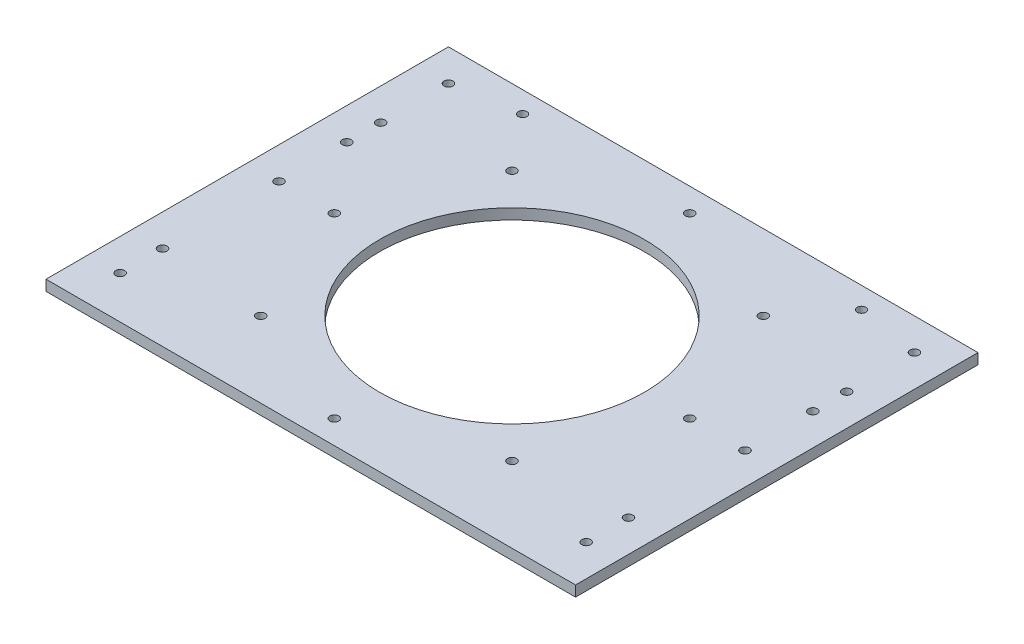
from build123d import *

# Parameters (mm, degrees)
SKETCH_1_W           = 250
SKETCH_1_H           = 190
EXTRUDE_1_DEPTH      = 5
SKETCH_2_R           = 2.1
CUT_EXTRUDE_1_DEPTH  = 10
SKETCH_3_R           = 62.5
CUT_EXTRUDE_2_DEPTH  = 10
CUT_EXTRUDE_3_REACH  = 159.083
SKETCH_4_R           = 2.1
SKETCH_5_OUTSIDE_W   = 314.81
SKETCH_5_OUTSIDE_H   = 254.81
SKETCH_5_OUTSIDE_W_2 = 250
SKETCH_5_OUTSIDE_H_2 = 190
SKETCH_5_OUTSIDE_R   = 2.05
CUT_EXTRUDE_4_DEPTH  = 10


with BuildPart() as part:
    # 草图1 → 凸台-拉伸1 (new body)
    with BuildSketch(Plane(origin=(0, 0, 0), x_dir=(1, 0, 0), z_dir=(0, 1, 0))):
        Rectangle(SKETCH_1_W, SKETCH_1_H)
    extrude(amount=EXTRUDE_1_DEPTH)

    # 草图2 → 切除-拉伸1 (cut)
    with BuildSketch(Plane(origin=(0, 5, 0), x_dir=(1, 0, 0), z_dir=(0, 1, 0))):
        with Locations(Location((-83.9, 0, 0), (0, 0, 270))):
            Circle(SKETCH_2_R)
        with Locations(Location((-59.326258942, 59.326258942, 0), (0, 0, 270))):
            Circle(SKETCH_2_R)
        with Locations(Location((0, 83.9, 0), (0, 0, 270))):
            Circle(SKETCH_2_R)
        with Locations(Location((59.326258942, 59.326258942, 0), (0, 0, 270))):
            Circle(SKETCH_2_R)
        with Locations(Location((83.9, 0, 0), (0, 0, 270))):
            Circle(SKETCH_2_R)
        with Locations(Location((59.326258942, -59.326258942, 0), (0, 0, 270))):
            Circle(SKETCH_2_R)
        with Locations(Location((0, -83.9, 0), (0, 0, 270))):
            Circle(SKETCH_2_R)
        with Locations(Location((-59.326258942, -59.326258942, 0), (0, 0, 270))):
            Circle(SKETCH_2_R)
    extrude(amount=-CUT_EXTRUDE_1_DEPTH, mode=Mode.SUBTRACT)

    # 草图3 → 切除-拉伸2 (cut)
    with BuildSketch(Plane(origin=(0, 5, 0), x_dir=(1, 0, 0), z_dir=(0, 1, 0))):
        with Locations(Location((0, 0, 0), (0, 0, 270))):
            Circle(SKETCH_3_R)
    extrude(amount=-CUT_EXTRUDE_2_DEPTH, mode=Mode.SUBTRACT)

    # 草图4 → 切除-拉伸3 (cut, up to next)
    with BuildSketch(Plane(origin=(0, 5, 0), x_dir=(1, 0, 0), z_dir=(0, 1, 0)), mode=Mode.PRIVATE) as cut_extrude_3_sk1:
        with Locations(Location((-110, 80, 0), (0, 0, 270))):
            Circle(SKETCH_4_R)
    cut_extrude_3_tool1 = extrude(cut_extrude_3_sk1.sketch, amount=-CUT_EXTRUDE_3_REACH, mode=Mode.PRIVATE) & part.part
    # 草图4 → 切除-拉伸3 (cut, up to next)
    with BuildSketch(Plane(origin=(0, 5, 0), x_dir=(1, 0, 0), z_dir=(0, 1, 0)), mode=Mode.PRIVATE) as cut_extrude_3_sk2:
        with Locations(Location((-110, 48, 0), (0, 0, 270))):
            Circle(SKETCH_4_R)
    cut_extrude_3_tool2 = extrude(cut_extrude_3_sk2.sketch, amount=-CUT_EXTRUDE_3_REACH, mode=Mode.PRIVATE) & part.part
    # 草图4 → 切除-拉伸3 (cut, up to next)
    with BuildSketch(Plane(origin=(0, 5, 0), x_dir=(1, 0, 0), z_dir=(0, 1, 0)), mode=Mode.PRIVATE) as cut_extrude_3_sk3:
        with Locations(Location((110, 48, 0), (0, 0, 270))):
            Circle(SKETCH_4_R)
    cut_extrude_3_tool3 = extrude(cut_extrude_3_sk3.sketch, amount=-CUT_EXTRUDE_3_REACH, mode=Mode.PRIVATE) & part.part
    # 草图4 → 切除-拉伸3 (cut, up to next)
    with BuildSketch(Plane(origin=(0, 5, 0), x_dir=(1, 0, 0), z_dir=(0, 1, 0)), mode=Mode.PRIVATE) as cut_extrude_3_sk4:
        with Locations(Location((110, 80, 0), (0, 0, 270))):
            Circle(SKETCH_4_R)
    cut_extrude_3_tool4 = extrude(cut_extrude_3_sk4.sketch, amount=-CUT_EXTRUDE_3_REACH, mode=Mode.PRIVATE) & part.part
    # 草图4 → 切除-拉伸3 (cut, up to next)
    with BuildSketch(Plane(origin=(0, 5, 0), x_dir=(1, 0, 0), z_dir=(0, 1, 0)), mode=Mode.PRIVATE) as cut_extrude_3_sk5:
        with Locations(Location((-110, -75, 0), (0, 0, 270))):
            Circle(SKETCH_4_R)
    cut_extrude_3_tool5 = extrude(cut_extrude_3_sk5.sketch, amount=-CUT_EXTRUDE_3_REACH, mode=Mode.PRIVATE) & part.part
    # 草图4 → 切除-拉伸3 (cut, up to next)
    with BuildSketch(Plane(origin=(0, 5, 0), x_dir=(1, 0, 0), z_dir=(0, 1, 0)), mode=Mode.PRIVATE) as cut_extrude_3_sk6:
        with Locations(Location((110, -75, 0), (0, 0, 270))):
            Circle(SKETCH_4_R)
    cut_extrude_3_tool6 = extrude(cut_extrude_3_sk6.sketch, amount=-CUT_EXTRUDE_3_REACH, mode=Mode.PRIVATE) & part.part
    # 草图4 → 切除-拉伸3 (cut, up to next)
    with BuildSketch(Plane(origin=(0, 5, 0), x_dir=(1, 0, 0), z_dir=(0, 1, 0)), mode=Mode.PRIVATE) as cut_extrude_3_sk7:
        with Locations(Location((-110, 32, 0), (0, 0, 270))):
            Circle(SKETCH_4_R)
    cut_extrude_3_tool7 = extrude(cut_extrude_3_sk7.sketch, amount=-CUT_EXTRUDE_3_REACH, mode=Mode.PRIVATE) & part.part
    # 草图4 → 切除-拉伸3 (cut, up to next)
    with BuildSketch(Plane(origin=(0, 5, 0), x_dir=(1, 0, 0), z_dir=(0, 1, 0)), mode=Mode.PRIVATE) as cut_extrude_3_sk8:
        with Locations(Location((-110, 0, 0), (0, 0, 270))):
            Circle(SKETCH_4_R)
    cut_extrude_3_tool8 = extrude(cut_extrude_3_sk8.sketch, amount=-CUT_EXTRUDE_3_REACH, mode=Mode.PRIVATE) & part.part
    # 草图4 → 切除-拉伸3 (cut, up to next)
    with BuildSketch(Plane(origin=(0, 5, 0), x_dir=(1, 0, 0), z_dir=(0, 1, 0)), mode=Mode.PRIVATE) as cut_extrude_3_sk9:
        with Locations(Location((110, 32, 0), (0, 0, 270))):
            Circle(SKETCH_4_R)
    cut_extrude_3_tool9 = extrude(cut_extrude_3_sk9.sketch, amount=-CUT_EXTRUDE_3_REACH, mode=Mode.PRIVATE) & part.part
    # 草图4 → 切除-拉伸3 (cut, up to next)
    with BuildSketch(Plane(origin=(0, 5, 0), x_dir=(1, 0, 0), z_dir=(0, 1, 0)), mode=Mode.PRIVATE) as cut_extrude_3_sk10:
        with Locations(Location((110, 0, 0), (0, 0, 270))):
            Circle(SKETCH_4_R)
    cut_extrude_3_tool10 = extrude(cut_extrude_3_sk10.sketch, amount=-CUT_EXTRUDE_3_REACH, mode=Mode.PRIVATE) & part.part
    # 草图4 → 切除-拉伸3 (cut, up to next)
    with BuildSketch(Plane(origin=(0, 5, 0), x_dir=(1, 0, 0), z_dir=(0, 1, 0)), mode=Mode.PRIVATE) as cut_extrude_3_sk11:
        with Locations(Location((-110, -55, 0), (0, 0, 270))):
            Circle(SKETCH_4_R)
    cut_extrude_3_tool11 = extrude(cut_extrude_3_sk11.sketch, amount=-CUT_EXTRUDE_3_REACH, mode=Mode.PRIVATE) & part.part
    # 草图4 → 切除-拉伸3 (cut, up to next)
    with BuildSketch(Plane(origin=(0, 5, 0), x_dir=(1, 0, 0), z_dir=(0, 1, 0)), mode=Mode.PRIVATE) as cut_extrude_3_sk12:
        with Locations(Location((110, -55, 0), (0, 0, 270))):
            Circle(SKETCH_4_R)
    cut_extrude_3_tool12 = extrude(cut_extrude_3_sk12.sketch, amount=-CUT_EXTRUDE_3_REACH, mode=Mode.PRIVATE) & part.part
    add(cut_extrude_3_tool1.solids().sort_by_distance((-110, 5, -80))[0], mode=Mode.SUBTRACT)
    add(cut_extrude_3_tool2.solids().sort_by_distance((-110, 5, -48))[0], mode=Mode.SUBTRACT)
    add(cut_extrude_3_tool3.solids().sort_by_distance((110, 5, -48))[0], mode=Mode.SUBTRACT)
    add(cut_extrude_3_tool4.solids().sort_by_distance((110, 5, -80))[0], mode=Mode.SUBTRACT)
    add(cut_extrude_3_tool5.solids().sort_by_distance((-110, 5, 75))[0], mode=Mode.SUBTRACT)
    add(cut_extrude_3_tool6.solids().sort_by_distance((110, 5, 75))[0], mode=Mode.SUBTRACT)
    add(cut_extrude_3_tool7.solids().sort_by_distance((-110, 5, -32))[0], mode=Mode.SUBTRACT)
    add(cut_extrude_3_tool8.solids().sort_by_distance((-110, 5, 0))[0], mode=Mode.SUBTRACT)
    add(cut_extrude_3_tool9.solids().sort_by_distance((110, 5, -32))[0], mode=Mode.SUBTRACT)
    add(cut_extrude_3_tool10.solids().sort_by_distance((110, 5, 0))[0], mode=Mode.SUBTRACT)
    add(cut_extrude_3_tool11.solids().sort_by_distance((-110, 5, 55))[0], mode=Mode.SUBTRACT)
    add(cut_extrude_3_tool12.solids().sort_by_distance((110, 5, 55))[0], mode=Mode.SUBTRACT)

    # 草图5 outside → 切除-拉伸4 (cut)
    # profile 1 of 3: a face of its own
    with BuildSketch(Plane(origin=(0, 5, 0), x_dir=(1, 0, 0), z_dir=(0, 1, 0))):
        Rectangle(SKETCH_5_OUTSIDE_W, SKETCH_5_OUTSIDE_H)
        Rectangle(SKETCH_5_OUTSIDE_W_2, SKETCH_5_OUTSIDE_H_2, mode=Mode.SUBTRACT)
    # profile 2 of 3: a face of its own
    with BuildSketch(Plane(origin=(0, 5, 0), x_dir=(1, 0, 0), z_dir=(0, 1, 0))):
        with Locations(Location((-80, 85, 0), (0, 0, 270))):
            Circle(SKETCH_5_OUTSIDE_R)
    # profile 3 of 3: a face of its own
    with BuildSketch(Plane(origin=(0, 5, 0), x_dir=(1, 0, 0), z_dir=(0, 1, 0))):
        with Locations(Location((80, 85, 0), (0, 0, 270))):
            Circle(SKETCH_5_OUTSIDE_R)
    extrude(amount=-CUT_EXTRUDE_4_DEPTH, mode=Mode.SUBTRACT)


solid = part.part
